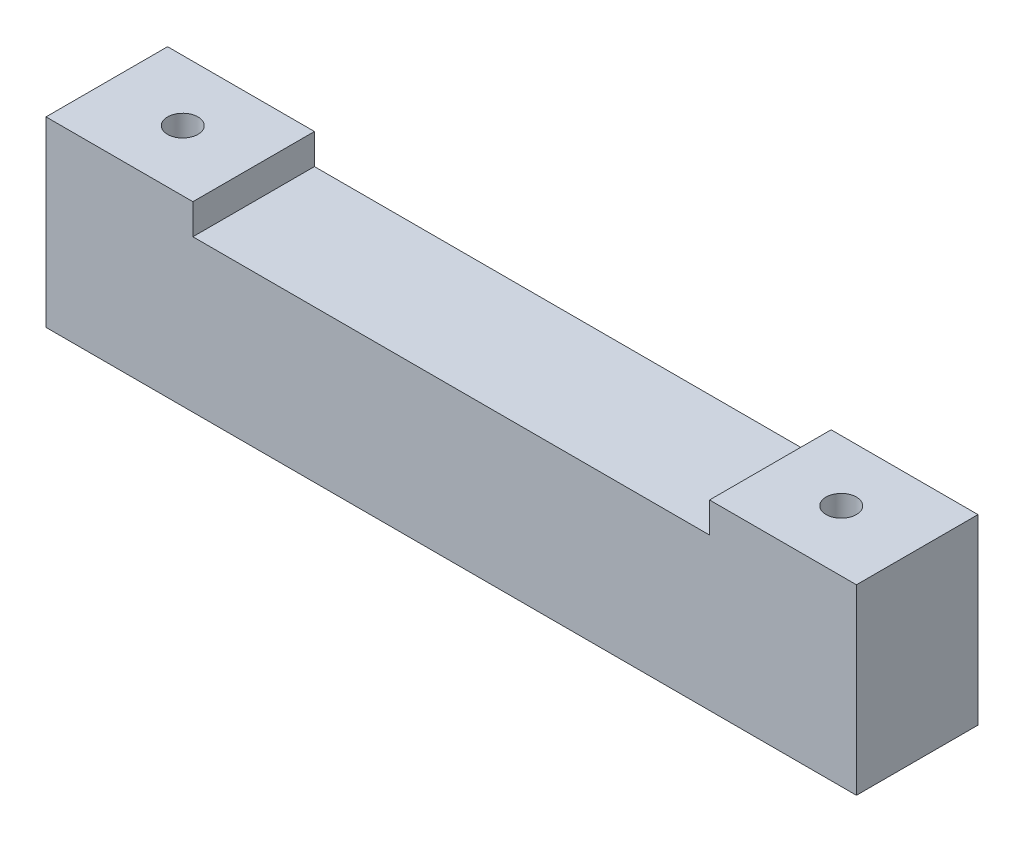
from build123d import *

# Parameters (mm, degrees)
EXTRUDE_1_DEPTH     = 12
SKETCH_2_R          = 1.5
CUT_EXTRUDE_1_DEPTH = 46.475268004


with BuildPart() as part:
    # 草图1 → 凸台-拉伸1 (new body)
    with BuildSketch(Plane.XY):
        Polygon((40, 0), (-40, 0), (-40, 18), (-25.5, 18), (-25.5, 15), (25.5, 15), (25.5, 18), (40, 18), align=None)
    extrude(amount=EXTRUDE_1_DEPTH)

    # 草图2 → 切除-拉伸1 (cut, through all)
    with BuildSketch(Plane.XZ):
        with Locations(Location((-32.5, 6, 0), (0, 0, 270))):
            Circle(SKETCH_2_R)
        with Locations(Location((32.5, 6, 0), (0, 0, 90))):
            Circle(SKETCH_2_R)
    extrude(amount=-CUT_EXTRUDE_1_DEPTH, mode=Mode.SUBTRACT)


solid = part.part
